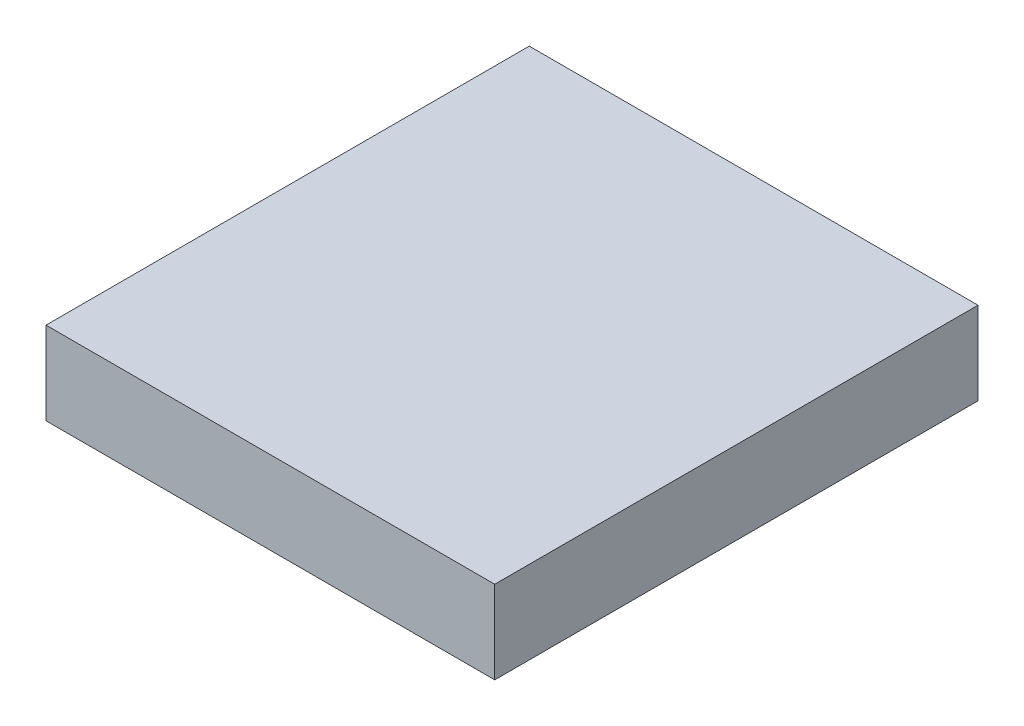
from build123d import *

# Parameters (mm, degrees)
ESQUISSE1_W        = 650
ESQUISSE1_H        = 700
BOSS_EXTRU_1_DEPTH = 120


with BuildPart() as part:
    # Esquisse1 → Boss.-Extru.1 (new body)
    with BuildSketch(Plane(origin=(0, 0, 0), x_dir=(1, 0, 0), z_dir=(0, 1, 0))):
        with Locations((325, 350)):
            Rectangle(ESQUISSE1_W, ESQUISSE1_H)
    extrude(amount=BOSS_EXTRU_1_DEPTH)


solid = part.part
